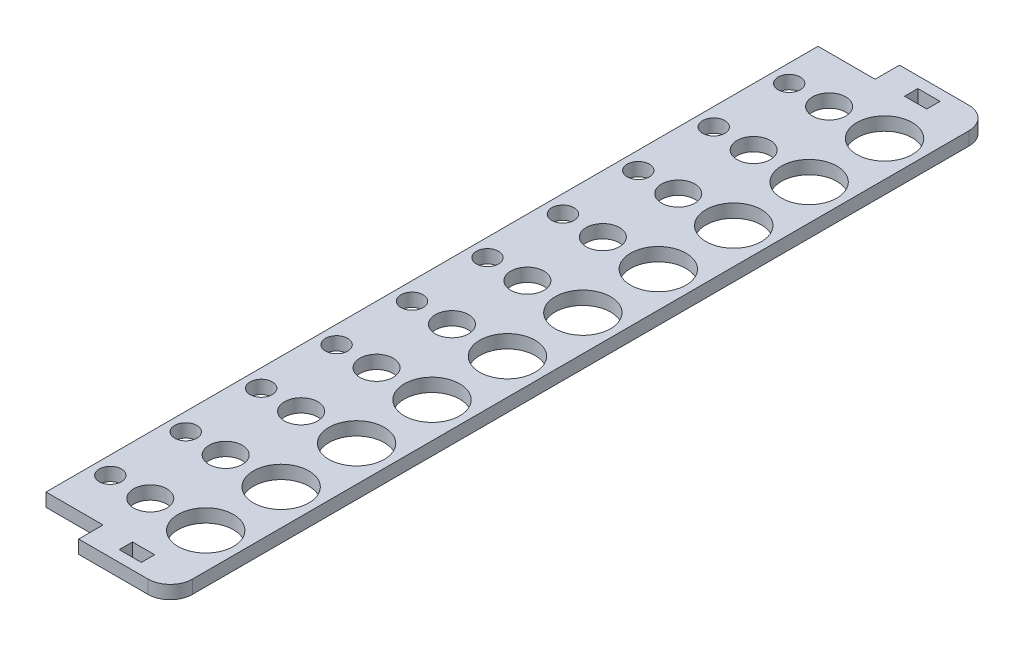
from build123d import *

# Parameters (mm, degrees)
ESQUISSE1_W             = 10
ESQUISSE1_H             = 6
BOSS_EXTRU_1_DEPTH      = 6
ESQUISSE2_R             = 12.5
ESQUISSE2_R_2           = 7.5
ESQUISSE2_R_3           = 5
ENL_V_MAT_EXTRU_1_DEPTH = 6
CONG_1_R                = 10


with BuildPart() as part:
    # Esquisse1 → Boss.-Extru.1 (new body)
    # profile 1 of 2: a face of its own
    with BuildSketch(Plane(origin=(0, 0, 0), x_dir=(1, 0, 0), z_dir=(0, 1, 0))):
        Polygon((0, 359), (0, 185), (67, 185), (67, 370), (25.728690358, 370), (25.728690358, 359), align=None)
        with Locations((44, 362)):
            Rectangle(ESQUISSE1_W, ESQUISSE1_H, mode=Mode.SUBTRACT)
    # profile 2 of 2: a face of its own
    with BuildSketch(Plane(origin=(0, 0, 0), x_dir=(1, 0, 0), z_dir=(0, 1, 0))):
        Polygon((67, 185), (0, 185), (0, 11), (25.728690358, 11), (25.728690358, 0), (67, 0), align=None)
        with Locations((44, 8)):
            Rectangle(ESQUISSE1_W, ESQUISSE1_H, mode=Mode.SUBTRACT)
    extrude(amount=BOSS_EXTRU_1_DEPTH)

    # Esquisse2 → Enlèv. mat.-Extru.1 (cut)
    with BuildSketch(Plane(origin=(0, 6, 0), x_dir=(1, 0, 0), z_dir=(0, 1, 0))):
        with Locations(Location((51, 338, 0), (0, 0, 270))):
            Circle(ESQUISSE2_R)
        with Locations(Location((51, 304, 0), (0, 0, 270))):
            Circle(ESQUISSE2_R)
        with Locations(Location((51, 270, 0), (0, 0, 270))):
            Circle(ESQUISSE2_R)
        with Locations(Location((51, 236, 0), (0, 0, 270))):
            Circle(ESQUISSE2_R)
        with Locations(Location((51, 202, 0), (0, 0, 270))):
            Circle(ESQUISSE2_R)
        with Locations(Location((51, 168, 0), (0, 0, 270))):
            Circle(ESQUISSE2_R)
        with Locations(Location((51, 134, 0), (0, 0, 270))):
            Circle(ESQUISSE2_R)
        with Locations(Location((51, 100, 0), (0, 0, 270))):
            Circle(ESQUISSE2_R)
        with Locations(Location((51, 66, 0), (0, 0, 270))):
            Circle(ESQUISSE2_R)
        with Locations(Location((26, 338, 0), (0, 0, 270))):
            Circle(ESQUISSE2_R_2)
        with Locations(Location((8, 338, 0), (0, 0, 270))):
            Circle(ESQUISSE2_R_3)
        with Locations(Location((26, 304, 0), (0, 0, 270))):
            Circle(ESQUISSE2_R_2)
        with Locations(Location((8, 304, 0), (0, 0, 270))):
            Circle(ESQUISSE2_R_3)
        with Locations(Location((26, 270, 0), (0, 0, 270))):
            Circle(ESQUISSE2_R_2)
        with Locations(Location((8, 270, 0), (0, 0, 270))):
            Circle(ESQUISSE2_R_3)
        with Locations(Location((26, 236, 0), (0, 0, 270))):
            Circle(ESQUISSE2_R_2)
        with Locations(Location((8, 236, 0), (0, 0, 270))):
            Circle(ESQUISSE2_R_3)
        with Locations(Location((26, 202, 0), (0, 0, 270))):
            Circle(ESQUISSE2_R_2)
        with Locations(Location((8, 202, 0), (0, 0, 270))):
            Circle(ESQUISSE2_R_3)
        with Locations(Location((26, 168, 0), (0, 0, 270))):
            Circle(ESQUISSE2_R_2)
        with Locations(Location((8, 168, 0), (0, 0, 270))):
            Circle(ESQUISSE2_R_3)
        with Locations(Location((26, 134, 0), (0, 0, 270))):
            Circle(ESQUISSE2_R_2)
        with Locations(Location((8, 134, 0), (0, 0, 270))):
            Circle(ESQUISSE2_R_3)
        with Locations(Location((26, 100, 0), (0, 0, 270))):
            Circle(ESQUISSE2_R_2)
        with Locations(Location((8, 100, 0), (0, 0, 270))):
            Circle(ESQUISSE2_R_3)
        with Locations(Location((26, 66, 0), (0, 0, 270))):
            Circle(ESQUISSE2_R_2)
        with Locations(Location((8, 66, 0), (0, 0, 270))):
            Circle(ESQUISSE2_R_3)
        with Locations(Location((26, 32, 0), (0, 0, 270))):
            Circle(ESQUISSE2_R_2)
        with Locations(Location((8, 32, 0), (0, 0, 270))):
            Circle(ESQUISSE2_R_3)
        with Locations(Location((51, 32, 0), (0, 0, 270))):
            Circle(ESQUISSE2_R)
    extrude(amount=-ENL_V_MAT_EXTRU_1_DEPTH, mode=Mode.SUBTRACT)

    # Congé1
    cong_1_edges = [part.edges().sort_by_distance(p)[0] for p in [
        (67, 3, -370),
        (67, 3, 0),
    ]]
    fillet(cong_1_edges, radius=CONG_1_R)


solid = part.part
